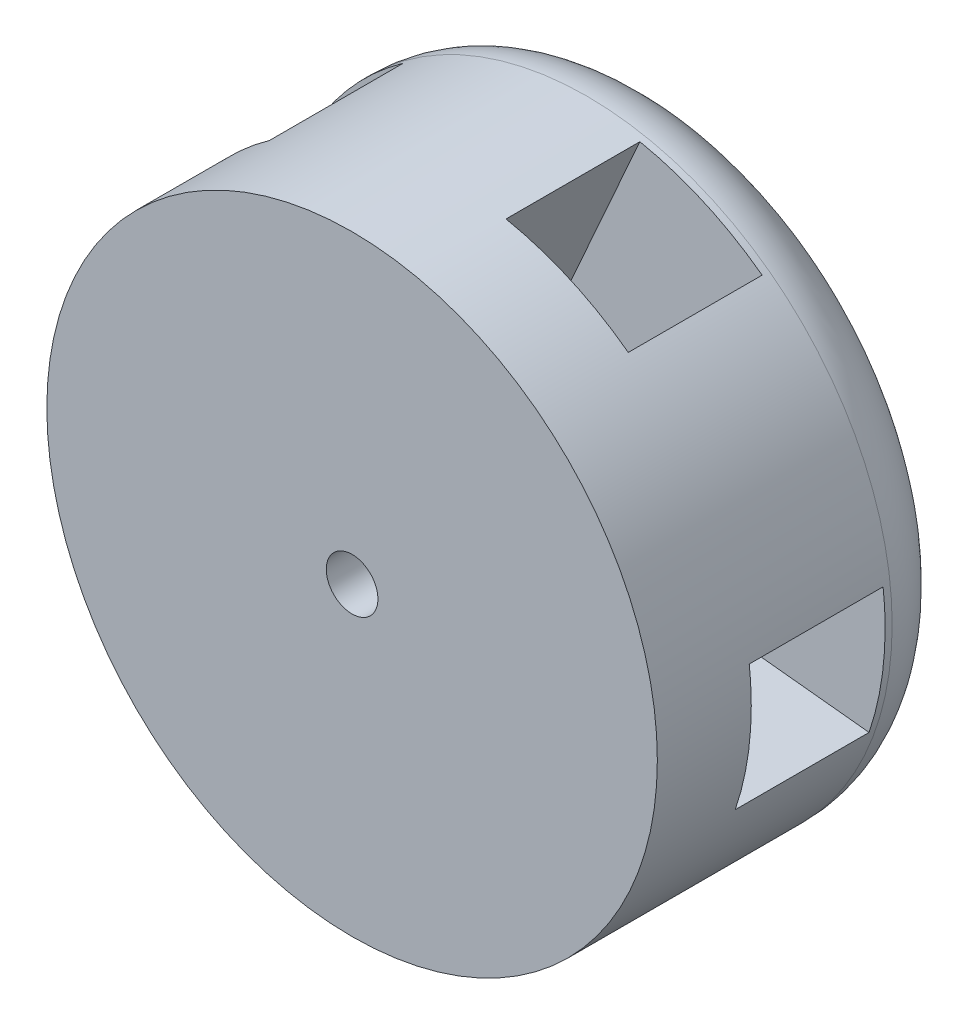
from build123d import *

# Parameters (mm, degrees)
SKETCH1_R           = 13
SKETCH1_R_2         = 1.1
BOSS_EXTRUDE1_DEPTH = 10
BOSS_EXTRUDE2_START = -3
SKETCH1_4_R         = 13
BOSS_EXTRUDE2_DEPTH = 3
FILLET1_R           = 3
SKETCH4_W           = 5.7
SKETCH4_H           = 5.7
CUT_EXTRUDE1_DEPTH  = 9
CIRPATTERN1_COUNT   = 5


with BuildPart() as part:
    # Sketch1 → Boss-Extrude1 (new body)
    with BuildSketch(Plane.XY):
        Circle(SKETCH1_R)
        Circle(SKETCH1_R_2, mode=Mode.SUBTRACT)
    extrude(amount=BOSS_EXTRUDE1_DEPTH)

    # Sketch1<4> → Boss-Extrude2 (add)
    with BuildSketch(Plane.XY.offset(BOSS_EXTRUDE2_START)):
        Circle(SKETCH1_4_R)
    extrude(amount=BOSS_EXTRUDE2_DEPTH)

    # Fillet1
    fillet1_edges = [part.edges().sort_by_distance(p)[0] for p in [
        (-13, 0, -3),
    ]]
    fillet(fillet1_edges, radius=FILLET1_R)

    # Sketch4 → Cut-Extrude1 (cut)
    with BuildSketch(Plane(origin=(-11.286443879, -6.451305765, 0), x_dir=(0.499999999999998, -0.8660254037844398, 0), z_dir=(0.8660254037844398, 0.499999999999998, 0))):
        with Locations((0.056227259, -3.15)):
            Rectangle(SKETCH4_W, SKETCH4_H)
    cut_extrude1 = extrude(amount=CUT_EXTRUDE1_DEPTH, mode=Mode.SUBTRACT)

    # CirPattern1: Cut-Extrude1 ×5 about axis
    cirpattern1_axis = Axis((0, 0, 10), (0, 0, -1))
    for i in range(1, CIRPATTERN1_COUNT):
        add(cut_extrude1.rotate(cirpattern1_axis, i * 360 / CIRPATTERN1_COUNT), mode=Mode.SUBTRACT)


solid = part.part
